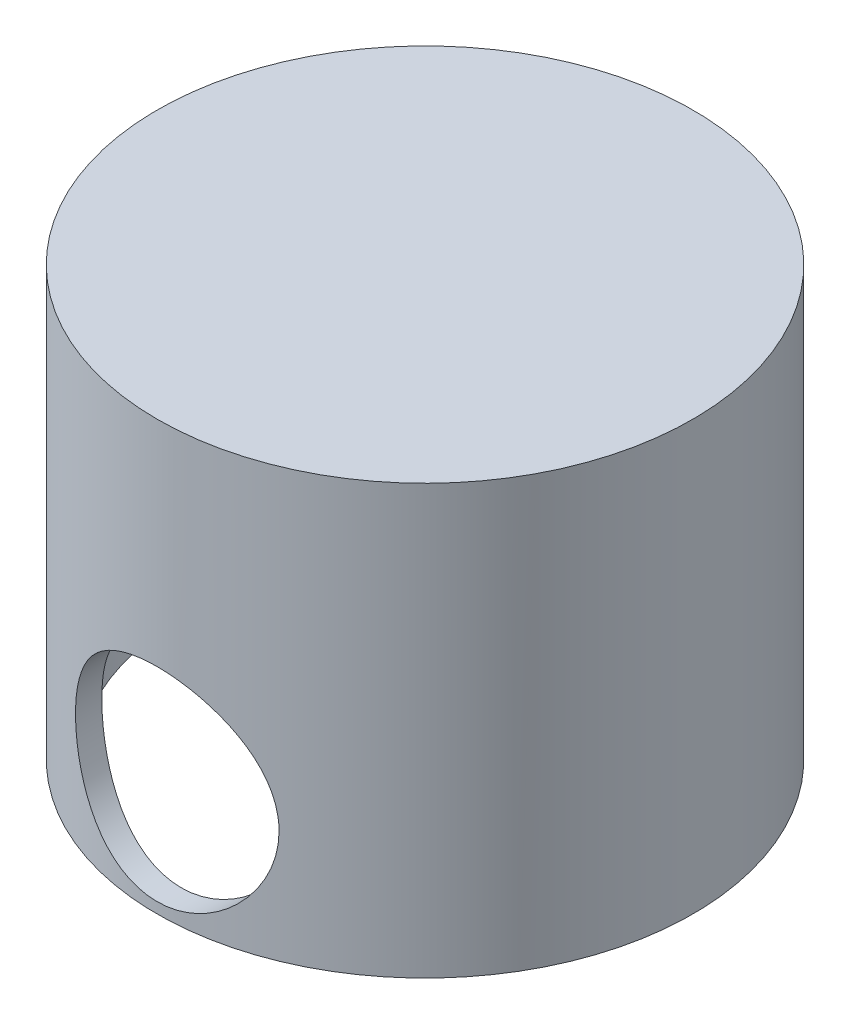
from build123d import *

# Parameters (mm, degrees)
SKETCH2_R               = 5
BOSS_EXTRUDE1_DEPTH     = 8
SKETCH4_R               = 4.55
CUT_EXTRUDE1_DEPTH      = 7.1
CUT_EXTRUDE2_DEPTH      = 11.677078252
CUT_EXTRUDE2_DEPTH_BACK = 11.677078252
SKETCH12_R              = 1.9
SKETCH13_W              = 3.8
SKETCH13_H              = 2.1
CUT_EXTRUDE3_DEPTH      = 10


with BuildPart() as part:
    # Sketch2 → Boss-Extrude1 (new body)
    with BuildSketch(Plane(origin=(0, 0, 0), x_dir=(1, 0, 0), z_dir=(0, 1, 0))):
        with Locations(Location((0, 0, 0), (0, 0, 270))):
            Circle(SKETCH2_R)
    extrude(amount=BOSS_EXTRUDE1_DEPTH)

    # Sketch4 → Cut-Extrude1 (cut)
    with BuildSketch(Plane(origin=(0, 0, 0), x_dir=(1, 0, 0), z_dir=(0, 1, 0))):
        with Locations(Location((0, 0, 0), (0, 0, 270))):
            Circle(SKETCH4_R)
    extrude(amount=CUT_EXTRUDE1_DEPTH, mode=Mode.SUBTRACT)

    # Sketch12 → Cut-Extrude2 (cut, two sides: drawn at the far end of the back side and taken through both)
    with BuildSketch(Plane.XY.offset(-CUT_EXTRUDE2_DEPTH_BACK)):
        with Locations((0, 2.1)):
            Circle(SKETCH12_R)
    extrude(amount=CUT_EXTRUDE2_DEPTH + CUT_EXTRUDE2_DEPTH_BACK, mode=Mode.SUBTRACT)

    # Sketch13 → Cut-Extrude3 (cut)
    with BuildSketch(Plane.XY):
        with Locations((0, 1.05)):
            Rectangle(SKETCH13_W, SKETCH13_H)
    extrude(amount=-CUT_EXTRUDE3_DEPTH, mode=Mode.SUBTRACT)


solid = part.part
